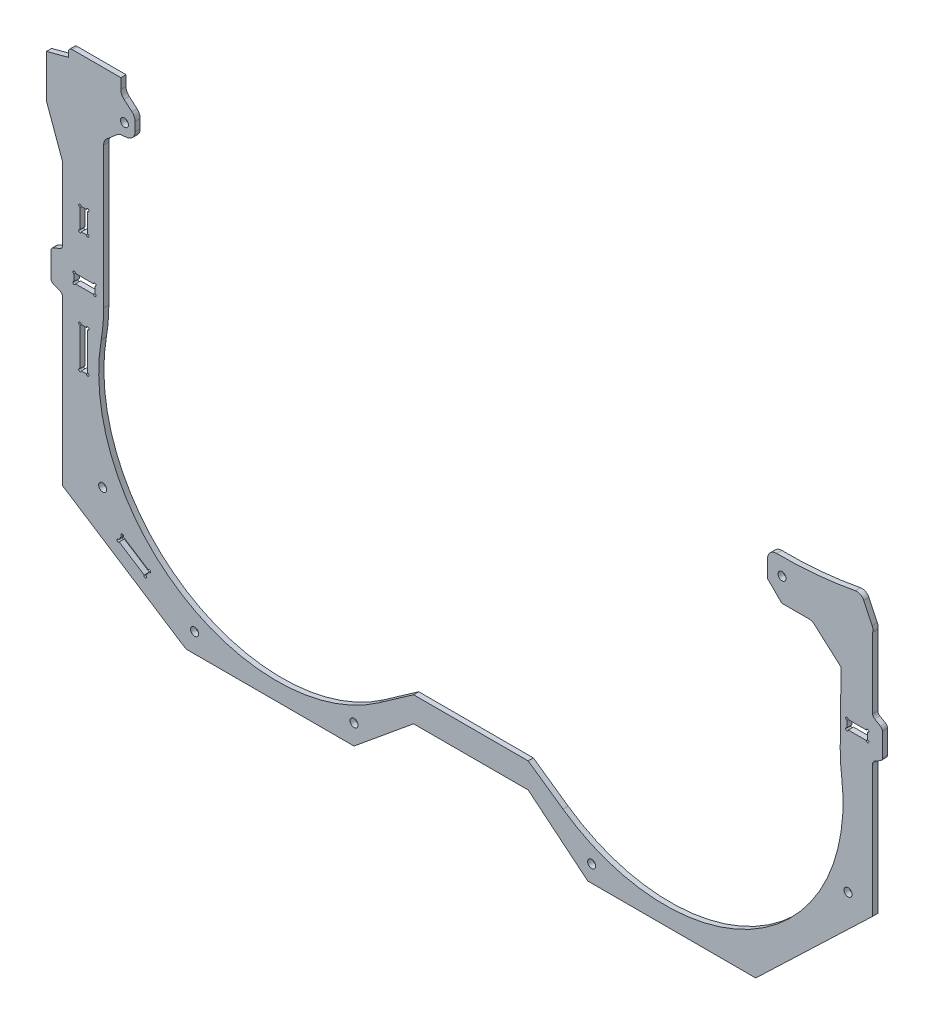
from build123d import *

# Parameters (mm, degrees)
SKETCH_1_R             = 1.55
SKETCH_1_W             = 8
SKETCH_1_H             = 3.5
EXTRUDE_1_DEPTH        = 2
EXTRUDE_START          = 2
EXTRUDE_2_DEPTH        = 2
FILLET_1_R             = 66.25
FILLET_4_R             = 1.5
SKETCH_7093_W          = 3
SKETCH_7093_H          = 15.5
SKETCH_7093_H_2        = 8.5
CUT_EXTRUDE_7585_DEPTH = 243.593574343
SKETCH_4_R             = 1.55
CUT_EXTRUDE_3_DEPTH    = 243.593574343
FILLET_5_R             = 3.5
SKETCH_8290_R          = 0.5
CUT_EXTRUDE_8728_DEPTH = 243.593574343


with BuildPart() as part:
    # 草图1 → 凸台-拉伸1 (new body)
    with BuildSketch(Plane.XY):
        with BuildLine():
            Line((155.184819061, -135.622927906), (110.023968778, -178.814555125))
            Line((110.023968778, -178.814555125), (45.146014647, -178.814555125))
            Line((45.146014647, -178.814555125), (22.125974708, -159.870216287))
            Line((22.125974708, -159.870216287), (-22.125974708, -159.870216287))
            Line((-22.125974708, -159.870216287), (-45.146014647, -178.814555125))
            Line((-45.146014647, -178.814555125), (-110.023968778, -178.814555125))
            Line((-110.023968778, -178.814555125), (-157.725302675, -148.011482983))
            Line((-157.725302675, -148.011482983), (-157.725302675, -39.583555807))
            Line((-157.725302675, -39.583555807), (-163.929854474, -22.461337388))
            Line((-163.929854474, -22.461337388), (-163.929854474, -5.84291361))
            Line((-163.929854474, -5.84291361), (-155.504077083, -3.600927376))
            Line((-155.504077083, -3.600927376), (-155.504077083, -0.25))
            Line((-155.504077083, -0.25), (-135.192862201, -0.25))
            Line((-135.192862201, -0.25), (-135.192862201, -5.85))
            Line((-135.192862201, -5.85), (-129.719705899, -10.576675864))
            Line((-129.719705899, -10.576675864), (-129.719705899, -18.798405758))
            Line((-129.719705899, -18.798405758), (-135.893457817, -19.398277466))
            Line((-135.893457817, -19.398277466), (-141.850432027, -24.52026455))
            Line((-141.850432027, -24.52026455), (-141.850432027, -87.17927527))
            ThreePointArc((-141.850432027, -87.17927527), (-143.273456416, -95.14794796), (-143.75, -103.228644035))
            ThreePointArc((-143.75, -103.228644035), (-106.74521716, -164.210638816), (-35.566620001, -159.54534708))
            Line((-35.566620001, -159.54534708), (-22.125974708, -150.134105928))
            Line((-22.125974708, -150.134105928), (22.125974708, -150.134105928))
            Line((22.125974708, -150.134105928), (35.566620001, -159.54534708))
            ThreePointArc((35.566620001, -159.54534708), (106.74521716, -164.210638816), (143.75, -103.228644035))
            ThreePointArc((143.75, -103.228644035), (143.461588771, -96.937907752), (142.598774895, -90.699951658))
            Line((142.598774895, -90.699951658), (142.966212817, -58.312660923))
            Line((142.966212817, -58.312660923), (131.782009345, -48.416521639))
            Line((131.782009345, -48.416521639), (120.077827626, -48.416521639))
            Line((120.077827626, -48.416521639), (114.577827626, -42.916521639))
            Line((114.577827626, -42.916521639), (114.577827626, -32.685002446))
            ThreePointArc((114.577827626, -32.685002446), (131.61274691, -32.289659724), (148.501080229, -30.024937097))
            ThreePointArc((148.501080229, -30.024937097), (150.418326561, -30.295579056), (151.770912833, -31.681072088))
            Line((151.770912833, -31.681072088), (155.01141709, -38.479630817))
            ThreePointArc((155.01141709, -38.479630817), (155.29338172, -39.526516509), (155.184819061, -40.605260155))
            Line((155.184819061, -40.605260155), (155.184819061, -135.622927906))
        make_face()
        with Locations((-133.806240002, -14.600927376)):
            Circle(SKETCH_1_R, mode=Mode.SUBTRACT)
        with Locations((120.182300402, -39.335)):
            Circle(SKETCH_1_R, mode=Mode.SUBTRACT)
        with Locations((149.25, -76.25)):
            Rectangle(SKETCH_1_W, SKETCH_1_H, mode=Mode.SUBTRACT)
        with Locations((-149.25, -76.25)):
            Rectangle(SKETCH_1_W, SKETCH_1_H, mode=Mode.SUBTRACT)
    extrude(amount=EXTRUDE_1_DEPTH)

    # 草图2 → 凸台-拉伸2 (add)
    with BuildSketch(Plane.XY.offset(EXTRUDE_START)):
        Polygon((155.184819061, -68.75), (158.934819061, -70.915063509), (158.934819061, -81.584936491), (155.184819061, -83.75), align=None)
        Polygon((-157.725302675, -68.75), (-157.725302675, -83.75), (-162.225302675, -81.886038969), (-162.225302675, -70.613961031), align=None)
    extrude(amount=-EXTRUDE_2_DEPTH)

    # 圆角1
    fillet_1_edges = [part.edges().sort_by_distance(p)[0] for p in [
        (-141.850432027, -87.17927527, 1),
        (142.598774895, -90.699951658, 1),
    ]]
    fillet(fillet_1_edges, radius=FILLET_1_R)

    # 圆角4
    fillet_4_edges = [part.edges().sort_by_distance(p)[0] for p in [
        (158.934819061, -81.584936491, 1),
        (158.934819061, -70.915063509, 1),
        (155.184819061, -68.75, 1),
        (155.184819061, -83.75, 1),
        (-162.225302675, -70.613961031, 1),
        (-162.225302675, -81.886038969, 1),
        (-157.725302675, -83.75, 1),
        (-157.725302675, -68.75, 1),
        (-155.504077083, -0.25, 1),
    ]]
    fillet(fillet_4_edges, radius=FILLET_4_R)

    # Sketch 7093 → Cut-Extrude 7585 (cut, through all)
    with BuildSketch(Plane.XY.offset(2)):
        with Locations((-149.5, -98.25)):
            Rectangle(SKETCH_7093_W, SKETCH_7093_H)
        with Locations((-149.5, -55.25)):
            Rectangle(SKETCH_7093_W, SKETCH_7093_H_2)
        Polygon((-134.649663794, -153.091956536), (-124.148766338, -159.87289693), (-125.776192033, -162.39311232), (-136.277089488, -155.612171926), align=None)
    extrude(amount=-CUT_EXTRUDE_7585_DEPTH, mode=Mode.SUBTRACT)

    # 草图4 → 切除-拉伸3 (cut, through all)
    with BuildSketch(Plane.XY):
        with Locations((-142.225302675, -140.821536198)):
            Circle(SKETCH_4_R)
        with Locations((-45.146014647, -171.064555125)):
            Circle(SKETCH_4_R)
        with Locations((-106.712983856, -171.314555125)):
            Circle(SKETCH_4_R)
        with Locations((46.656002152, -172.314555125)):
            Circle(SKETCH_4_R)
        with Locations((145.684819061, -132.301036976)):
            Circle(SKETCH_4_R)
    extrude(amount=CUT_EXTRUDE_3_DEPTH, mode=Mode.SUBTRACT)

    # 圆角5
    fillet_5_edges = [part.edges().sort_by_distance(p)[0] for p in [
        (-135.192862201, -5.85, 1),
        (-129.719705899, -10.576675864, 1),
        (-129.719705899, -18.798405758, 1),
        (-135.893457817, -19.398277466, 1),
        (-141.850432027, -24.52026455, 1),
        (131.782009345, -48.416521639, 1),
        (114.577827626, -32.685002446, 1),
    ]]
    fillet(fillet_5_edges, radius=FILLET_5_R)

    # Sketch 8290 → Cut-Extrude 8728 (cut, through all)
    with BuildSketch(Plane.XY):
        with Locations((-151, -51)):
            Circle(SKETCH_8290_R)
        with Locations((-148, -51)):
            Circle(SKETCH_8290_R)
        with Locations((-151, -59.5)):
            Circle(SKETCH_8290_R)
        with Locations((-148, -59.5)):
            Circle(SKETCH_8290_R)
        with Locations((-153.25, -74.5)):
            Circle(SKETCH_8290_R)
        with Locations((-145.25, -74.5)):
            Circle(SKETCH_8290_R)
        with Locations((-145.25, -78)):
            Circle(SKETCH_8290_R)
        with Locations((-153.25, -78)):
            Circle(SKETCH_8290_R)
        with Locations((-151, -90.5)):
            Circle(SKETCH_8290_R)
        with Locations((-148, -90.5)):
            Circle(SKETCH_8290_R)
        with Locations((-151, -106)):
            Circle(SKETCH_8290_R)
        with Locations((-148, -106)):
            Circle(SKETCH_8290_R)
        with Locations((-134.649663794, -153.091956536)):
            Circle(SKETCH_8290_R)
        with Locations((-136.277089488, -155.612171926)):
            Circle(SKETCH_8290_R)
        with Locations((-124.148766338, -159.87289693)):
            Circle(SKETCH_8290_R)
        with Locations((-125.776192033, -162.39311232)):
            Circle(SKETCH_8290_R)
        with Locations((145.25, -74.5)):
            Circle(SKETCH_8290_R)
        with Locations((153.25, -74.5)):
            Circle(SKETCH_8290_R)
        with Locations((153.25, -78)):
            Circle(SKETCH_8290_R)
        with Locations((145.25, -78)):
            Circle(SKETCH_8290_R)
    extrude(amount=CUT_EXTRUDE_8728_DEPTH, mode=Mode.SUBTRACT)


solid = part.part
